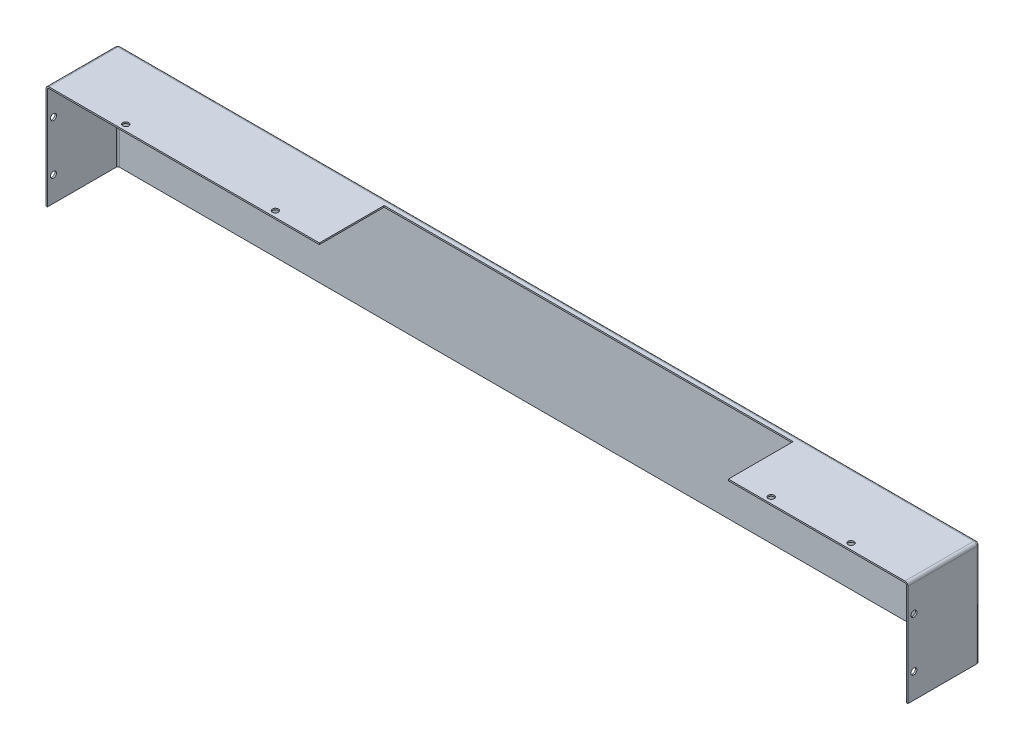
from build123d import *

# Parameters (mm, degrees)
SKETCH_1_W          = 864
SKETCH_1_H          = 105
EXTRUDE_1_DEPTH     = 72
FILLET_1_R          = 3
SHELL_1_T           = -1.5
SKETCH_3_W          = 410
SKETCH_3_H          = 65
CUT_EXTRUDE_2_DEPTH = 65
SKETCH_4_R          = 3
CUT_EXTRUDE_3_DEPTH = 874.329834599
SKETCH_5_R          = 3
CUT_EXTRUDE_4_DEPTH = 10


with BuildPart() as part:
    # 草图1 → 凸台-拉伸1 (new body)
    with BuildSketch(Plane.XY):
        with Locations((432, 52.5)):
            Rectangle(SKETCH_1_W, SKETCH_1_H)
    extrude(amount=EXTRUDE_1_DEPTH)

    # 圆角1
    fillet_1_edges = [part.edges().sort_by_distance(p)[0] for p in [
        (432, 105, 0),
        (864, 52.5, 0),
        (0, 52.5, 0),
        (0, 105, 36),
        (864, 105, 36),
    ]]
    fillet(fillet_1_edges, radius=FILLET_1_R)

    # 抽壳1
    shell_1_openings = [part.faces().sort_by_distance(p)[0] for p in [
        (432, 52.497793003, 72),
        (432, 0, 36.002193962),
    ]]
    offset(amount=SHELL_1_T, openings=shell_1_openings, kind=Kind.INTERSECTION)

    # 草图3 → 切除-拉伸2 (cut)
    with BuildSketch(Plane(origin=(0, 105, 0), x_dir=(1, 0, 0), z_dir=(0, 1, 0))):
        with Locations((479, -39.5)):
            Rectangle(SKETCH_3_W, SKETCH_3_H)
    extrude(amount=-CUT_EXTRUDE_2_DEPTH, mode=Mode.SUBTRACT)

    # 草图4 → 切除-拉伸3 (cut, through all)
    with BuildSketch(Plane(origin=(864, 0, 0), x_dir=(0, 0, -1), z_dir=(1, 0, 0))):
        with Locations((-66, 75)):
            Circle(SKETCH_4_R)
        with Locations((-66, 25)):
            Circle(SKETCH_4_R)
    extrude(amount=-CUT_EXTRUDE_3_DEPTH, mode=Mode.SUBTRACT)

    # 草图5 → 切除-拉伸4 (cut)
    with BuildSketch(Plane(origin=(0, 105, 0), x_dir=(1, 0, 0), z_dir=(0, 1, 0))):
        with Locations(Location((721, -66, 0), (0, 0, 270))):
            Circle(SKETCH_5_R)
        with Locations(Location((801, -66, 0), (0, 0, 270))):
            Circle(SKETCH_5_R)
        with Locations(Location((74, -66, 0), (0, 0, 270))):
            Circle(SKETCH_5_R)
        with Locations(Location((224, -66, 0), (0, 0, 270))):
            Circle(SKETCH_5_R)
    extrude(amount=-CUT_EXTRUDE_4_DEPTH, mode=Mode.SUBTRACT)


solid = part.part
